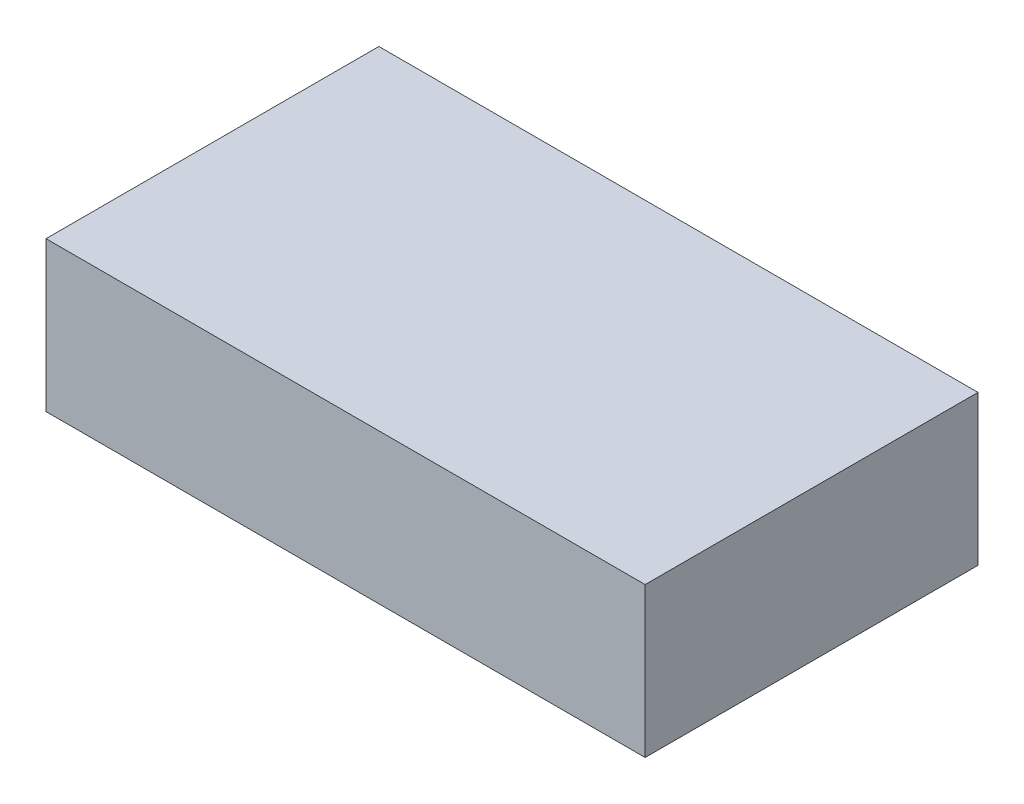
from build123d import *

# Parameters (mm, degrees)
SKETCH1_W           = 57.15
SKETCH1_H           = 31.75
BOSS_EXTRUDE1_DEPTH = 14.2875


with BuildPart() as part:
    # Sketch1 → Boss-Extrude1 (new body)
    with BuildSketch(Plane(origin=(0, 0, 0), x_dir=(1, 0, 0), z_dir=(0, 1, 0))):
        with Locations((28.575, 15.875)):
            Rectangle(SKETCH1_W, SKETCH1_H)
    extrude(amount=BOSS_EXTRUDE1_DEPTH)


solid = part.part
